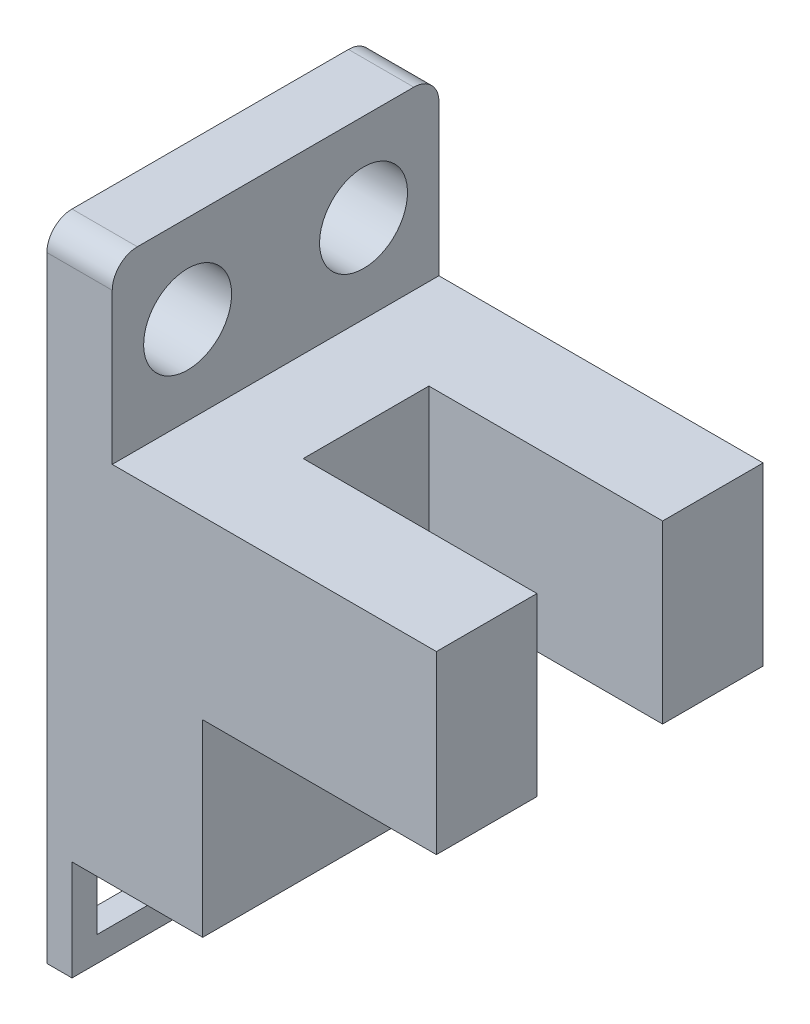
from build123d import *

# Parameters (mm, degrees)
EXTRUDE_1_DEPTH     = 6.5
SKETCH_2_W          = 9.3
SKETCH_2_H          = 5
CUT_EXTRUDE_1_DEPTH = 14.601102896
SKETCH_3_R          = 1.75
EXTRUDE_2_DEPTH     = 2.6
SKETCH_4_W          = 13
SKETCH_4_H          = 4
SKETCH_4_W_2        = 11
SKETCH_4_H_2        = 2
EXTRUDE_3_DEPTH     = 1


with BuildPart() as part:
    # 草图1 → 凸台-拉伸1 (new, symmetric)
    with BuildSketch(Plane.XY):
        Polygon((0, 0), (9.3, 0), (9.3, 7), (-6.2, 7), (-6.2, -7.5), (0, -7.5), align=None)
    extrude(amount=EXTRUDE_1_DEPTH, both=True)

    # 草图2 → 切除-拉伸1 (cut, through all)
    with BuildSketch(Plane.XZ):
        with Locations((4.65, 0)):
            Rectangle(SKETCH_2_W, SKETCH_2_H)
    extrude(amount=-CUT_EXTRUDE_1_DEPTH, mode=Mode.SUBTRACT)

    # 草图3 → 凸台-拉伸2 (add)
    with BuildSketch(Plane.ZY.offset(6.2)):
        with BuildLine():
            Line((5.5, 14), (-5.5, 14))
            ThreePointArc((-5.5, 14), (-6.207106781, 13.707106781), (-6.5, 13))
            Line((-6.5, 13), (-6.5, 7))
            Line((-6.5, 7), (6.5, 7))
            Line((6.5, 7), (6.5, 13))
            ThreePointArc((6.5, 13), (6.207106781, 13.707106781), (5.5, 14))
        make_face()
        with Locations(Location((-3.5, 10.5, 0), (0, 0, 270))):
            Circle(SKETCH_3_R, mode=Mode.SUBTRACT)
        with Locations(Location((3.5, 10.5, 0), (0, 0, 90))):
            Circle(SKETCH_3_R, mode=Mode.SUBTRACT)
    extrude(amount=-EXTRUDE_2_DEPTH)

    # 草图4 → 凸台-拉伸3 (add)
    with BuildSketch(Plane.ZY.offset(6.2)):
        with Locations((0, -9.5)):
            Rectangle(SKETCH_4_W, SKETCH_4_H)
        with Locations((0, -9.5)):
            Rectangle(SKETCH_4_W_2, SKETCH_4_H_2, mode=Mode.SUBTRACT)
    extrude(amount=-EXTRUDE_3_DEPTH)


solid = part.part
